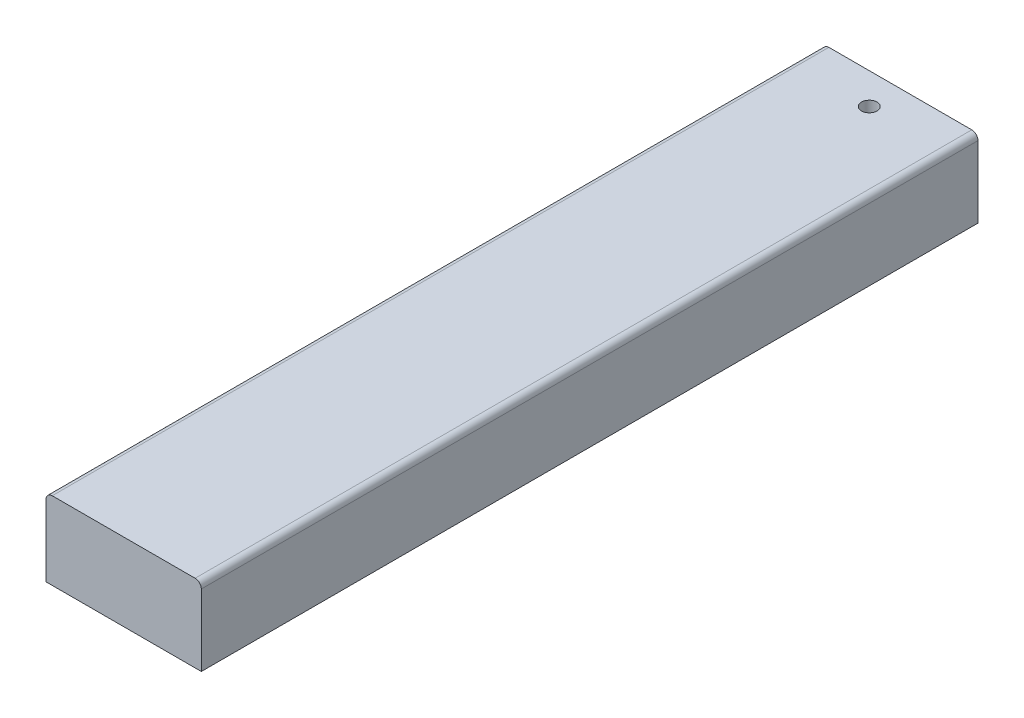
from build123d import *

# Parameters (mm, degrees)
SKETCH1_W               = 50
SKETCH1_H               = 20
BOSS_EXTRUDE1_DEPTH     = 125
SKETCH3_W               = 50
SKETCH3_H               = 250
BOSS_EXTRUDE2_DEPTH     = 5
CUT_EXTRUDE1_DEPTH      = 130.903810568
CUT_EXTRUDE1_DEPTH_BACK = 10
SKETCH2_R               = 2.5
FILLET1_R               = 2


with BuildPart() as part:
    # Sketch1 → Boss-Extrude1 (new, symmetric)
    with BuildSketch(Plane.XY):
        Rectangle(SKETCH1_W, SKETCH1_H)
    extrude(amount=BOSS_EXTRUDE1_DEPTH, both=True)

    # Sketch3 → Boss-Extrude2 (add)
    with BuildSketch(Plane(origin=(0, 10, 0), x_dir=(1, 0, 0), z_dir=(0, 1, 0))):
        Rectangle(SKETCH3_W, SKETCH3_H)
    extrude(amount=BOSS_EXTRUDE2_DEPTH)

    # Sketch2 → Cut-Extrude1 (cut, two sides: drawn at the far end of the back side and taken through both)
    with BuildSketch(Plane(origin=(0, 15, 0), x_dir=(1, 0, 0), z_dir=(0, 1, 0)).offset(-CUT_EXTRUDE1_DEPTH_BACK)):
        with Locations(Location((0, 115, 0), (0, 0, 90))):
            Circle(SKETCH2_R)
    extrude(amount=CUT_EXTRUDE1_DEPTH + CUT_EXTRUDE1_DEPTH_BACK, mode=Mode.SUBTRACT)

    # Fillet1
    fillet1_edges = [part.edges().sort_by_distance(p)[0] for p in [
        (-25, 15, 0),
        (25, 15, 0),
    ]]
    fillet(fillet1_edges, radius=FILLET1_R)


solid = part.part
